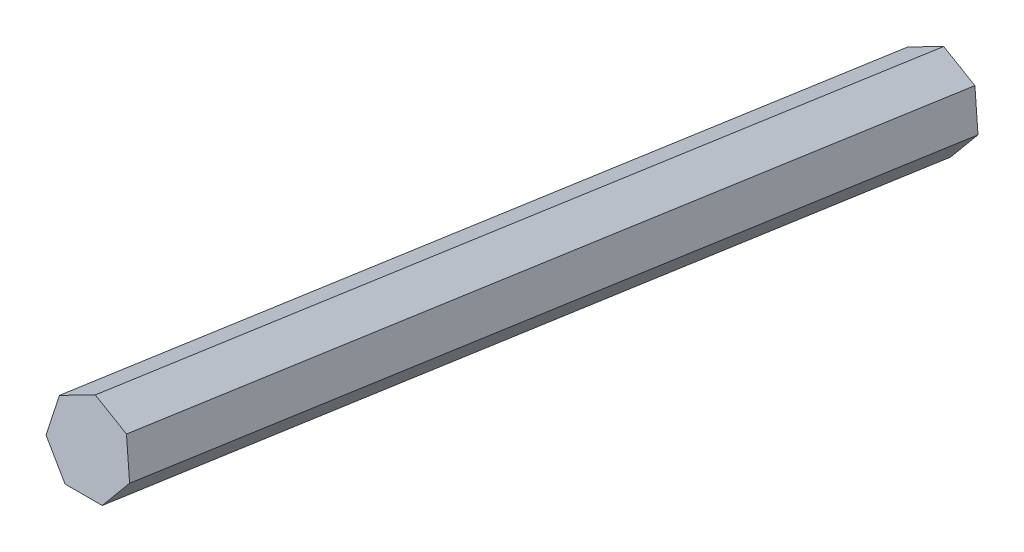
from build123d import *


with BuildPart() as part:
    # Sweep1: sweep along a path in Sketch1
    with BuildLine(Plane(origin=(0, 0, 0), x_dir=(0, 0, -1), z_dir=(1, 0, 0))) as sweep1_path:
        Line((69.282032303, 0), (0, 10))
    # Sketch2 → Sweep1 (sweep)
    with BuildSketch(Plane(origin=(0, 0, -69.282032303), x_dir=(1, 0, 0), z_dir=(0, 0.14285714285714282, 0.989743318610787))):
        Polygon((0, 3.5), (-2.736410189, 2.182214307), (-3.412247693, -0.778823269), (-1.518593087, -3.153391038), (1.518593087, -3.153391038), (3.412247693, -0.778823269), (2.736410189, 2.182214307), align=None)
    sweep(path=sweep1_path.line)


solid = part.part
